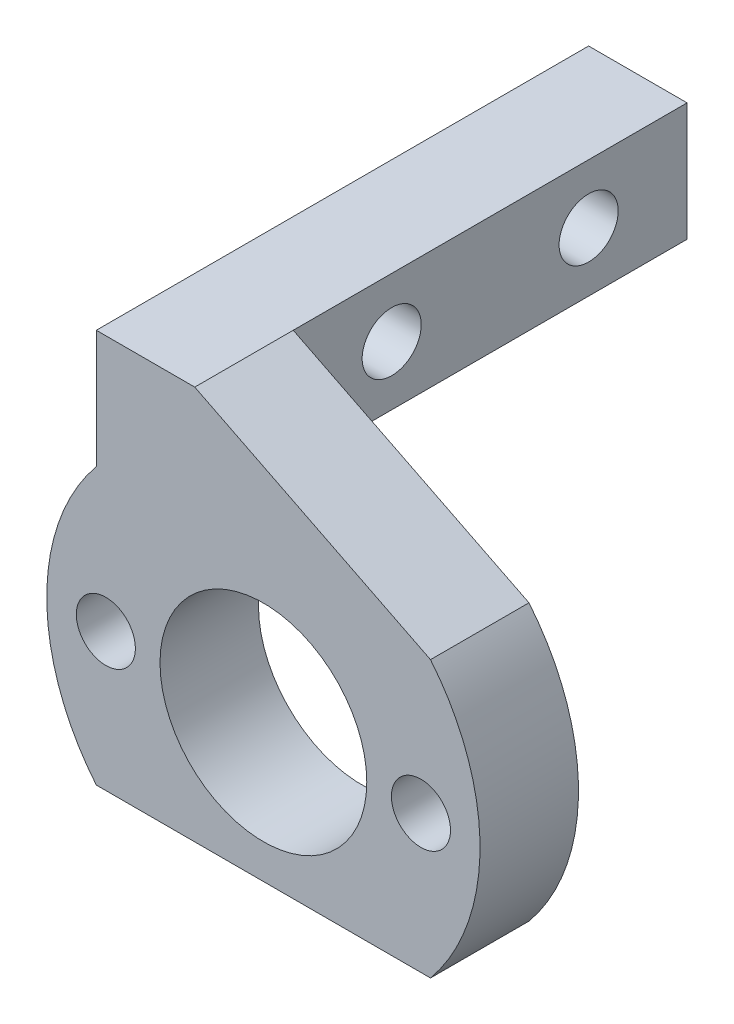
from build123d import *

# Parameters (mm, degrees)
SKETCH_1_W      = 20
SKETCH_1_H      = 6
SKETCH_1_R      = 1.5
EXTRUDE_1_DEPTH = 5
SKETCH_2_R      = 1.5
SKETCH_2_R_2    = 5.25
EXTRUDE_2_DEPTH = 5


with BuildPart() as part:
    # 草图1 → 凸台-拉伸1 (new body)
    with BuildSketch(Plane(origin=(0, 0, 0), x_dir=(0, 0, -1), z_dir=(1, 0, 0))):
        with Locations((10, 3)):
            Rectangle(SKETCH_1_W, SKETCH_1_H)
        with Locations((5, 3)):
            Circle(SKETCH_1_R, mode=Mode.SUBTRACT)
        with Locations((15, 3)):
            Circle(SKETCH_1_R, mode=Mode.SUBTRACT)
    extrude(amount=EXTRUDE_1_DEPTH)

    # 草图2 → 凸台-拉伸2 (add)
    # profile 1 of 2: a face of its own
    with BuildSketch(Plane.XY):
        with BuildLine():
            ThreePointArc((0, 0), (-2.514718626, -7), (0, -14))
            Line((0, -14), (16.970562748, -14))
            ThreePointArc((16.970562748, -14), (19.485281374, -7), (16.970562748, 0))
            Line((16.970562748, 0), (0, 0))
        make_face()
        with Locations((0.485281374, -7)):
            Circle(SKETCH_2_R, mode=Mode.SUBTRACT)
        with Locations((8.485281374, -7)):
            Circle(SKETCH_2_R_2, mode=Mode.SUBTRACT)
        with Locations((16.485281374, -7)):
            Circle(SKETCH_2_R, mode=Mode.SUBTRACT)
    # profile 2 of 2: a face of its own
    with BuildSketch(Plane.XY):
        Polygon((0, 6), (0, 0), (16.970562748, 0), (5, 6), align=None)
    extrude(amount=EXTRUDE_2_DEPTH)


solid = part.part
